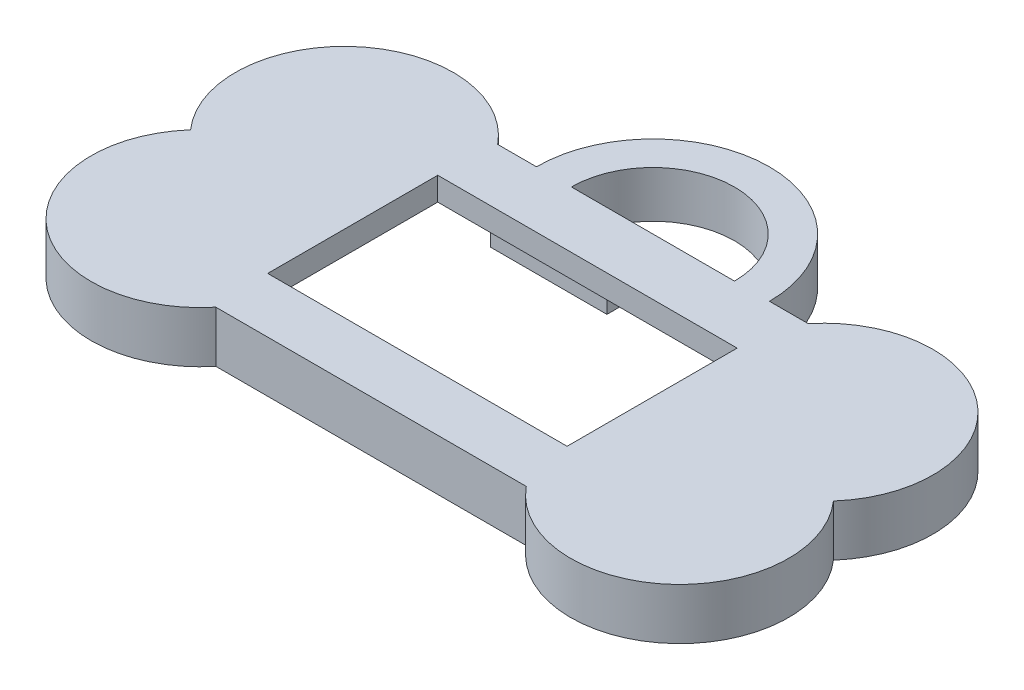
from build123d import *
from build123d.topology import SkipClean

# Parameters (mm, degrees)
BOSS_EXTRUDE1_DEPTH = 2.54
SKETCH3_W           = 32.640662211
SKETCH3_H           = 18.538410016
BOSS_EXTRUDE3_DEPTH = 2.54
BOSS_EXTRUDE5_START = 0.508
BOSS_EXTRUDE5_DEPTH = 0.508


with BuildPart() as part:
    # Sketch1 → Boss-Extrude1 (new body)
    with BuildSketch(Plane(origin=(0, 0, 0), x_dir=(1, 0, 0), z_dir=(0, 1, 0))):
        with BuildLine():
            ThreePointArc((-39.649349134, 1.286034678), (-38.429647834, -15.641923347), (-21.52975616, -14.08080337))
            Line((-21.52975616, -14.08080337), (12.321775162, -14.079871626))
            ThreePointArc((12.321775162, -14.079871626), (29.221293553, -15.641366687), (30.440421584, 1.286294566))
            ThreePointArc((30.440421584, 1.286294566), (29.220717841, 18.214253603), (12.320825474, 16.653128255))
            Line((12.320825474, 16.653128255), (8.095060057, 16.653011943))
            ThreePointArc((8.095060057, 16.653011943), (-4.605289499, 29.352662378), (-17.304939934, 16.652312823))
            Line((-17.304939934, 16.652312823), (-21.530705351, 16.652196511))
            ThreePointArc((-21.530705351, 16.652196511), (-38.430218697, 18.213690635), (-39.649349134, 1.286034678))
        make_face()
        with BuildLine():
            Line((4.285060058, 16.652907075), (-13.494939935, 16.652417691))
            ThreePointArc((-13.494939935, 16.652417691), (-4.605184631, 25.54266238), (4.285060058, 16.652907075))
        make_face(mode=Mode.SUBTRACT)
        with BuildLine():
            Line((-4.604964725, 11.637139843), (-4.604964725, 14.112662381))
            Line((-4.604964725, 14.112662381), (13.620033749, 14.113164014))
            ThreePointArc((13.620033749, 14.113164014), (28.108622145, 15.790575731), (26.57403613, 1.28616435))
            ThreePointArc((26.57403613, 1.28616435), (28.109123124, -13.217754754), (13.6210332, -11.539835864))
            Line((13.6210332, -11.539835864), (12.321775162, -11.539871625))
            Line((12.321775162, -11.539871625), (12.321775162, -9.03008529))
            Line((12.321775162, -9.03008529), (1.640510114, -9.03008529))
            Line((1.640510114, -9.03008529), (1.640510114, -11.540165621))
            Line((1.640510114, -11.540165621), (-10.954952329, -11.540512304))
            Line((-10.954952329, -11.540512304), (-10.954952329, -9.03008529))
            Line((-10.954952329, -9.03008529), (-21.52975616, -9.03008529))
            Line((-21.52975616, -9.03008529), (-21.52975616, -11.540803369))
            Line((-21.52975616, -11.540803369), (-22.828963748, -11.540839129))
            ThreePointArc((-22.828963748, -11.540839129), (-22.947503255, -11.725155299), (-23.070333709, -11.906640133))
            Line((-23.070333709, -11.906640133), (-23.070333709, -12.058667845))
            Line((-23.070333709, -12.058667845), (-23.177995711, -12.058508621))
            ThreePointArc((-23.177995711, -12.058508621), (-37.535703997, -12.994889522), (-35.782964221, 1.28616435))
            ThreePointArc((-35.782964221, 1.28616435), (-35.926521617, 1.379963865), (-36.0683329, 1.476382925))
            ThreePointArc((-36.0683329, 1.476382925), (-37.19509177, 15.909614485), (-22.829963199, 14.112160749))
            Line((-22.829963199, 14.112160749), (-17.304939934, 14.112312822))
            Line((-17.304939934, 14.112312822), (-17.304939934, 11.637139843))
            Line((-17.304939934, 11.637139843), (-4.604964725, 11.637139843))
        make_face(mode=Mode.SUBTRACT)
    extrude(amount=BOSS_EXTRUDE1_DEPTH)

    # Sketch3 → Boss-Extrude3 (add)
    with BuildSketch(Plane(origin=(0, 2.54, 0), x_dir=(1, 0, 0), z_dir=(0, 1, 0))):
        with BuildLine():
            Line((12.320825474, 16.653128255), (8.095060057, 16.653011943))
            ThreePointArc((8.095060057, 16.653011943), (-4.605289499, 29.352662378), (-17.304939934, 16.652312823))
            Line((-17.304939934, 16.652312823), (-21.530705351, 16.652196511))
            ThreePointArc((-21.530705351, 16.652196511), (-38.430218697, 18.213690635), (-39.649349134, 1.286034678))
            ThreePointArc((-39.649349134, 1.286034678), (-38.429647834, -15.641923347), (-21.52975616, -14.08080337))
            Line((-21.52975616, -14.08080337), (12.321775162, -14.079871626))
            ThreePointArc((12.321775162, -14.079871626), (29.221293553, -15.641366687), (30.440421584, 1.286294566))
            ThreePointArc((30.440421584, 1.286294566), (29.220717841, 18.214253603), (12.320825474, 16.653128255))
        make_face()
        with BuildLine():
            Line((-13.494939935, 16.652417691), (4.285060058, 16.652907075))
            ThreePointArc((4.285060058, 16.652907075), (-4.605184631, 25.54266238), (-13.494939935, 16.652417691))
        make_face(mode=Mode.SUBTRACT)
        with Locations((-5.565360914, 1.202786927)):
            Rectangle(SKETCH3_W, SKETCH3_H, mode=Mode.SUBTRACT)
    extrude(amount=BOSS_EXTRUDE3_DEPTH)

    # Sketch4 → Boss-Extrude5 (add)
    with SkipClean():  # the faces are left unmerged after this step: merging them gives an invalid solid
        with BuildSketch(Plane.XZ.offset(BOSS_EXTRUDE5_START)):
            with BuildLine():
                Line((4.285060058, -16.652907075), (8.095060057, -16.653011943))
                Line((8.095060057, -16.653011943), (12.320825474, -16.653128255))
                ThreePointArc((12.320825474, -16.653128255), (29.220717841, -18.214253603), (30.440421584, -1.286294566))
                ThreePointArc((30.440421584, -1.286294566), (29.221293553, 15.641366687), (12.321775162, 14.079871626))
                Line((12.321775162, 14.079871626), (-21.52975616, 14.08080337))
                ThreePointArc((-21.52975616, 14.08080337), (-38.429647834, 15.641923347), (-39.649349134, -1.286034678))
                ThreePointArc((-39.649349134, -1.286034678), (-38.430218697, -18.213690635), (-21.530705351, -16.652196511))
                Line((-21.530705351, -16.652196511), (-17.304939934, -16.652312823))
                Line((-17.304939934, -16.652312823), (-13.494939935, -16.652417691))
                Line((-13.494939935, -16.652417691), (4.285060058, -16.652907075))
            make_face()
            with BuildLine():
                Line((-22.552623375, 12.048831523), (13.344678341, 12.04784347))
                ThreePointArc((13.344678341, 12.04784347), (28.299197198, 13.740578889), (27.463139128, -1.286197025))
                ThreePointArc((27.463139128, -1.286197025), (28.298681008, -16.313414565), (13.343693226, -14.621156408))
                Line((13.343693226, -14.621156408), (8.095115986, -14.621011944))
                Line((8.095115986, -14.621011944), (-17.304884004, -14.620312824))
                Line((-17.304884004, -14.620312824), (-22.553608377, -14.620168355))
                ThreePointArc((-22.553608377, -14.620168355), (-37.508122345, -16.31290289), (-36.672067047, -1.286131788))
                ThreePointArc((-36.672067047, -1.286131788), (-37.507610583, 13.741084507), (-22.552623375, 12.048831523))
            make_face(mode=Mode.SUBTRACT)
        extrude(amount=-BOSS_EXTRUDE5_DEPTH)


solid = part.part
